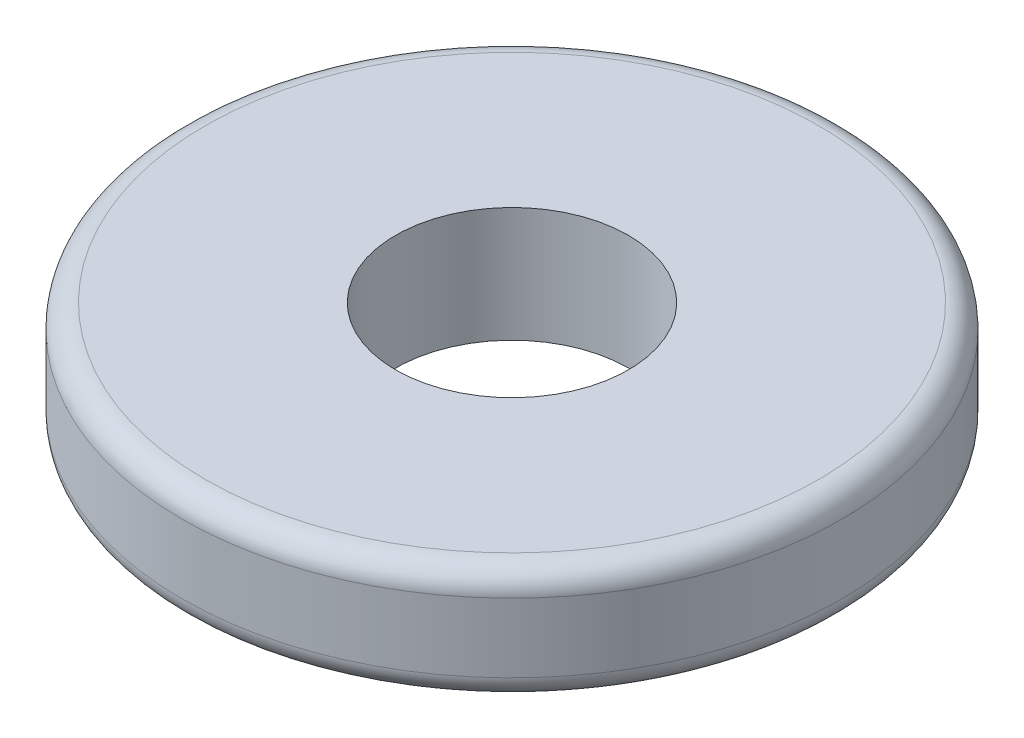
from build123d import *

# Parameters (mm, degrees)
SKETCH1_R           = 4.3
SKETCH1_R_2         = 1.52
BOSS_EXTRUDE3_DEPTH = 1.5
FILLET3_R           = 0.3


with BuildPart() as part:
    # Sketch1 → Boss-Extrude3 (new body)
    with BuildSketch(Plane(origin=(0, 0, 0), x_dir=(1, 0, 0), z_dir=(0, 1, 0))):
        with Locations(Location((0, 0, 0), (0, 0, 270))):
            Circle(SKETCH1_R)
        with Locations(Location((0, 0, 0), (0, 0, 270))):
            Circle(SKETCH1_R_2, mode=Mode.SUBTRACT)
    extrude(amount=BOSS_EXTRUDE3_DEPTH)

    # Fillet3
    fillet3_edges = [part.edges().sort_by_distance(p)[0] for p in [
        (0, 0, -4.3),
        (0, 1.5, -4.3),
    ]]
    fillet(fillet3_edges, radius=FILLET3_R)


solid = part.part
